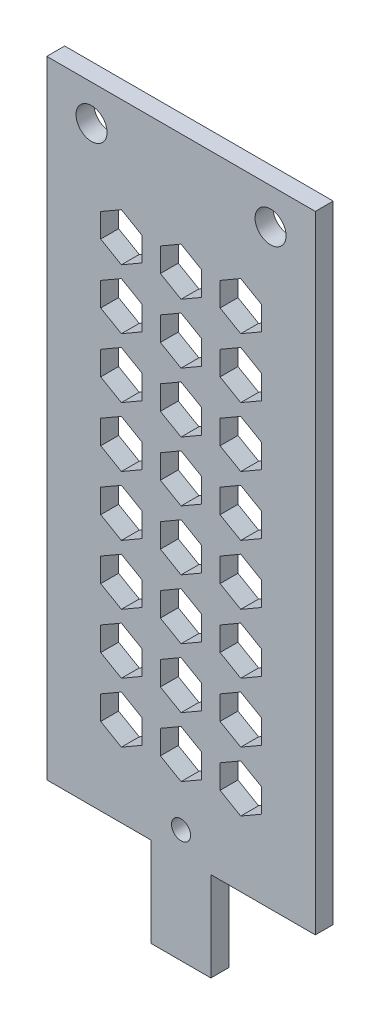
from build123d import *

# Parameters (mm, degrees)
SKETCH_2_W          = 45
SKETCH_2_H          = 120
SKETCH_2_R          = 2.6
SKETCH_2_R_2        = 1.6
EXTRUDE_1_DEPTH     = 3
SKETCH_3_W          = 17.5
SKETCH_3_H          = 15
CUT_EXTRUDE_1_DEPTH = 3


with BuildPart() as part:
    # 草图2 → 凸台-拉伸1 (new body)
    with BuildSketch(Plane.XY):
        Rectangle(SKETCH_2_W, SKETCH_2_H)
        with Locations((-15, 54)):
            Circle(SKETCH_2_R, mode=Mode.SUBTRACT)
        with Locations((15, 54)):
            Circle(SKETCH_2_R, mode=Mode.SUBTRACT)
        with Locations((0, -41)):
            Circle(SKETCH_2_R_2, mode=Mode.SUBTRACT)
        Polygon((10, 4), (6.535898385, 2), (6.535898385, -2), (10, -4), (13.464101615, -2), (13.464101615, 2), align=None, mode=Mode.SUBTRACT)
        Polygon((0, 4), (-3.464101615, 2), (-3.464101615, -2), (0, -4), (3.464101615, -2), (3.464101615, 2), align=None, mode=Mode.SUBTRACT)
        Polygon((-10, 4), (-13.464101615, 2), (-13.464101615, -2), (-10, -4), (-6.535898385, -2), (-6.535898385, 2), align=None, mode=Mode.SUBTRACT)
        Polygon((10, 14), (6.535898385, 12), (6.535898385, 8), (10, 6), (13.464101615, 8), (13.464101615, 12), align=None, mode=Mode.SUBTRACT)
        Polygon((0, 14), (-3.464101615, 12), (-3.464101615, 8), (0, 6), (3.464101615, 8), (3.464101615, 12), align=None, mode=Mode.SUBTRACT)
        Polygon((-10, 14), (-13.464101615, 12), (-13.464101615, 8), (-10, 6), (-6.535898385, 8), (-6.535898385, 12), align=None, mode=Mode.SUBTRACT)
        Polygon((10, 24), (6.535898385, 22), (6.535898385, 18), (10, 16), (13.464101615, 18), (13.464101615, 22), align=None, mode=Mode.SUBTRACT)
        Polygon((0, 24), (-3.464101615, 22), (-3.464101615, 18), (0, 16), (3.464101615, 18), (3.464101615, 22), align=None, mode=Mode.SUBTRACT)
        Polygon((-10, 24), (-13.464101615, 22), (-13.464101615, 18), (-10, 16), (-6.535898385, 18), (-6.535898385, 22), align=None, mode=Mode.SUBTRACT)
        Polygon((10, 34), (6.535898385, 32), (6.535898385, 28), (10, 26), (13.464101615, 28), (13.464101615, 32), align=None, mode=Mode.SUBTRACT)
        Polygon((0, 34), (-3.464101615, 32), (-3.464101615, 28), (0, 26), (3.464101615, 28), (3.464101615, 32), align=None, mode=Mode.SUBTRACT)
        Polygon((-10, 34), (-13.464101615, 32), (-13.464101615, 28), (-10, 26), (-6.535898385, 28), (-6.535898385, 32), align=None, mode=Mode.SUBTRACT)
        Polygon((10, 44), (6.535898385, 42), (6.535898385, 38), (10, 36), (13.464101615, 38), (13.464101615, 42), align=None, mode=Mode.SUBTRACT)
        Polygon((0, 44), (-3.464101615, 42), (-3.464101615, 38), (0, 36), (3.464101615, 38), (3.464101615, 42), align=None, mode=Mode.SUBTRACT)
        Polygon((-10, 44), (-13.464101615, 42), (-13.464101615, 38), (-10, 36), (-6.535898385, 38), (-6.535898385, 42), align=None, mode=Mode.SUBTRACT)
        Polygon((-10, -6), (-13.464101615, -8), (-13.464101615, -12), (-10, -14), (-6.535898385, -12), (-6.535898385, -8), align=None, mode=Mode.SUBTRACT)
        Polygon((0, -6), (-3.464101615, -8), (-3.464101615, -12), (0, -14), (3.464101615, -12), (3.464101615, -8), align=None, mode=Mode.SUBTRACT)
        Polygon((10, -6), (6.535898385, -8), (6.535898385, -12), (10, -14), (13.464101615, -12), (13.464101615, -8), align=None, mode=Mode.SUBTRACT)
        Polygon((-10, -16), (-13.464101615, -18), (-13.464101615, -22), (-10, -24), (-6.535898385, -22), (-6.535898385, -18), align=None, mode=Mode.SUBTRACT)
        Polygon((0, -16), (-3.464101615, -18), (-3.464101615, -22), (0, -24), (3.464101615, -22), (3.464101615, -18), align=None, mode=Mode.SUBTRACT)
        Polygon((10, -16), (6.535898385, -18), (6.535898385, -22), (10, -24), (13.464101615, -22), (13.464101615, -18), align=None, mode=Mode.SUBTRACT)
        Polygon((-10, -26), (-13.464101615, -28), (-13.464101615, -32), (-10, -34), (-6.535898385, -32), (-6.535898385, -28), align=None, mode=Mode.SUBTRACT)
        Polygon((0, -26), (-3.464101615, -28), (-3.464101615, -32), (0, -34), (3.464101615, -32), (3.464101615, -28), align=None, mode=Mode.SUBTRACT)
        Polygon((10, -26), (6.535898385, -28), (6.535898385, -32), (10, -34), (13.464101615, -32), (13.464101615, -28), align=None, mode=Mode.SUBTRACT)
    extrude(amount=EXTRUDE_1_DEPTH)

    # 草图3 → 切除-拉伸1 (cut)
    with BuildSketch(Plane.XY.offset(3)):
        with Locations((-13.75, -52.5)):
            Rectangle(SKETCH_3_W, SKETCH_3_H)
        with Locations((13.75, -52.5)):
            Rectangle(SKETCH_3_W, SKETCH_3_H)
    extrude(amount=-CUT_EXTRUDE_1_DEPTH, mode=Mode.SUBTRACT)


solid = part.part
